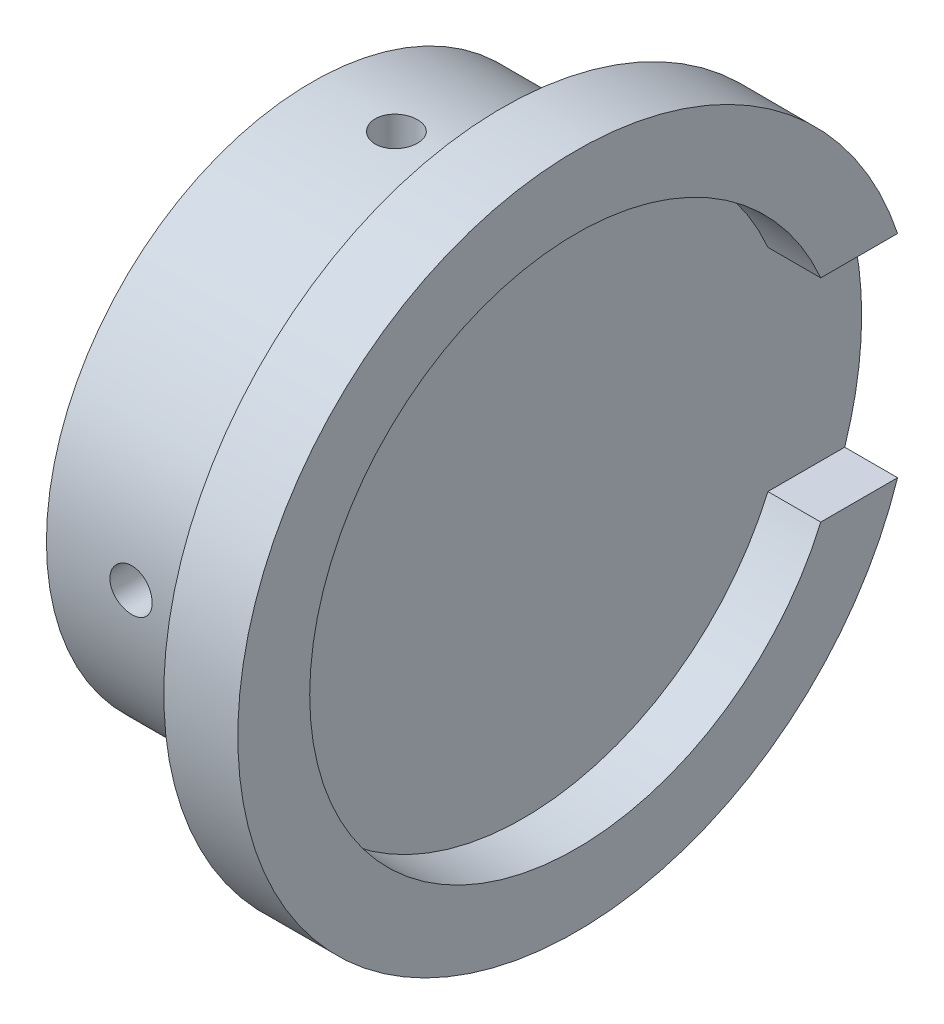
from build123d import *

# Parameters (mm, degrees)
SKETCH_1_R                      = 12.55
EXTRUDE_1_DEPTH                 = 10
SKETCH_2_R                      = 3
CUT_EXTRUDE_1_DEPTH             = 7
CUT_EXTRUDE_2_REACH             = 22.372
SKETCH_3_R                      = 1
CUT_EXTRUDE_2_DIRECTION_2_REACH = 22.372
CUT_EXTRUDE_3_DEPTH             = 21
CUT_EXTRUDE_3_DEPTH_BACK        = 19
SKETCH_4_R                      = 1
EXTRUDE_2_DEPTH                 = 2.5
EXTRUDE_2_DEPTH_BACK            = 1
SKETCH_5_R                      = 16
SKETCH_6_R                      = 12.6
CUT_EXTRUDE_4_DEPTH             = 2.5
FILLET_1_R                      = 2
SKETCH_7_W                      = 2.5
SKETCH_7_H                      = 10
CUT_EXTRUDE_5_DEPTH             = 21.5
CUT_EXTRUDE_7_DEPTH             = 1.5
SKETCH_13_W                     = 4.62
SKETCH_13_H                     = 1.5
CUT_EXTRUDE_8_DEPTH             = 4
SKETCH_14_W                     = 1.5
SKETCH_14_H                     = 4.62
CUT_EXTRUDE_9_DEPTH             = 4
CUT_EXTRUDE_10_DEPTH            = 1.5


with BuildPart() as part:
    # 草图1 → 凸台-拉伸1 (new body)
    with BuildSketch(Plane(origin=(0, 0, 0), x_dir=(0, 0, -1), z_dir=(1, 0, 0))):
        Circle(SKETCH_1_R)
    extrude(amount=EXTRUDE_1_DEPTH)

    # 草图2 → 切除-拉伸1 (cut)
    with BuildSketch(Plane.ZY):
        Circle(SKETCH_2_R)
    extrude(amount=-CUT_EXTRUDE_1_DEPTH, mode=Mode.SUBTRACT)

    # 草图3 → 切除-拉伸2 (cut, up to next)
    with BuildSketch(Plane(origin=(0, 0, 0), x_dir=(1, 0, 0), z_dir=(0, 1, 0)), mode=Mode.PRIVATE) as cut_extrude_2_sk1:
        with Locations(Location((4, 0, 0), (0, 0, 270))):
            Circle(SKETCH_3_R)
    cut_extrude_2_tool1 = extrude(cut_extrude_2_sk1.sketch, amount=-CUT_EXTRUDE_2_REACH, mode=Mode.PRIVATE) & part.part
    add(cut_extrude_2_tool1.solids().sort_by_distance((4, 0, 0))[0], mode=Mode.SUBTRACT)

    # 草图3 → 切除-拉伸2 direction 2 (cut, up to next)
    with BuildSketch(Plane(origin=(0, 0, 0), x_dir=(1, 0, 0), z_dir=(0, 1, 0)), mode=Mode.PRIVATE) as cut_extrude_2_direction_2_sk1:
        with Locations(Location((4, 0, 0), (0, 0, 270))):
            Circle(SKETCH_3_R)
    cut_extrude_2_direction_2_tool1 = extrude(cut_extrude_2_direction_2_sk1.sketch, amount=CUT_EXTRUDE_2_DIRECTION_2_REACH, mode=Mode.PRIVATE) & part.part
    add(cut_extrude_2_direction_2_tool1.solids().sort_by_distance((4, 0, 0))[0], mode=Mode.SUBTRACT)

    # 草图4 → 切除-拉伸3 (cut, two sides: drawn at the far end of the back side and taken through both)
    with BuildSketch(Plane.XY.offset(-CUT_EXTRUDE_3_DEPTH_BACK)):
        with Locations(Location((4, 0, 0), (0, 0, 180))):
            Circle(SKETCH_4_R)
    extrude(amount=CUT_EXTRUDE_3_DEPTH + CUT_EXTRUDE_3_DEPTH_BACK, mode=Mode.SUBTRACT)

    # 草图5 → 凸台-拉伸2 (add, two sides: drawn at the far end of the back side and taken through both)
    with BuildSketch(Plane(origin=(10, 0, 0), x_dir=(0, 0, -1), z_dir=(1, 0, 0)).offset(-EXTRUDE_2_DEPTH_BACK)):
        Circle(SKETCH_5_R)
    extrude(amount=EXTRUDE_2_DEPTH + EXTRUDE_2_DEPTH_BACK)

    # 草图6 → 切除-拉伸4 (cut)
    with BuildSketch(Plane(origin=(12.5, 0, 0), x_dir=(0, 0, -1), z_dir=(1, 0, 0))):
        Circle(SKETCH_6_R)
    extrude(amount=-CUT_EXTRUDE_4_DEPTH, mode=Mode.SUBTRACT)

    # 圆角1
    fillet_1_edges = [part.edges().sort_by_distance(p)[0] for p in [
        (9, 0, 12.55),
    ]]
    fillet(fillet_1_edges, radius=FILLET_1_R)

    # 草图7 → 切除-拉伸5 (cut)
    with BuildSketch(Plane.XY):
        with Locations((11.25, 0)):
            Rectangle(SKETCH_7_W, SKETCH_7_H)
    extrude(amount=-CUT_EXTRUDE_5_DEPTH, mode=Mode.SUBTRACT)

    # 草图11 → 切除-拉伸7 (cut)
    with BuildSketch(Plane(origin=(0, 6, 0), x_dir=(1, 0, 0), z_dir=(0, 1, 0))):
        Polygon((4, 2.309401077), (2, 1.154700538), (2, -1.154700538), (4, -2.309401077), (6, -1.154700538), (6, 1.154700538), align=None)
    cut_extrude_7 = extrude(amount=CUT_EXTRUDE_7_DEPTH, mode=Mode.SUBTRACT)

    # 草图13 → 切除-拉伸8 (cut)
    with BuildSketch(Plane.ZY):
        with Locations((0, 6.75)):
            Rectangle(SKETCH_13_W, SKETCH_13_H)
    cut_extrude_8 = extrude(amount=-CUT_EXTRUDE_8_DEPTH, mode=Mode.SUBTRACT)

    # 草图14 → 切除-拉伸9 (cut)
    with BuildSketch(Plane.ZY):
        with Locations((6.75, 0)):
            Rectangle(SKETCH_14_W, SKETCH_14_H)
    cut_extrude_9 = extrude(amount=-CUT_EXTRUDE_9_DEPTH, mode=Mode.SUBTRACT)

    # 草图9 → 切除-拉伸10 (cut)
    with BuildSketch(Plane.XY.offset(6)):
        Polygon((4, 2.309401077), (2, 1.154700538), (2, -1.154700538), (4, -2.309401077), (6, -1.154700538), (6, 1.154700538), align=None)
    cut_extrude_10 = extrude(amount=CUT_EXTRUDE_10_DEPTH, mode=Mode.SUBTRACT)

    # 镜向1: 切除-拉伸9, 切除-拉伸10 across plane
    add(cut_extrude_9.mirror(Plane.XY), mode=Mode.SUBTRACT)
    add(cut_extrude_10.mirror(Plane.XY), mode=Mode.SUBTRACT)

    # 镜向2: 切除-拉伸7, 切除-拉伸8 across plane
    add(cut_extrude_7.mirror(Plane.ZX), mode=Mode.SUBTRACT)
    add(cut_extrude_8.mirror(Plane.ZX), mode=Mode.SUBTRACT)


solid = part.part
